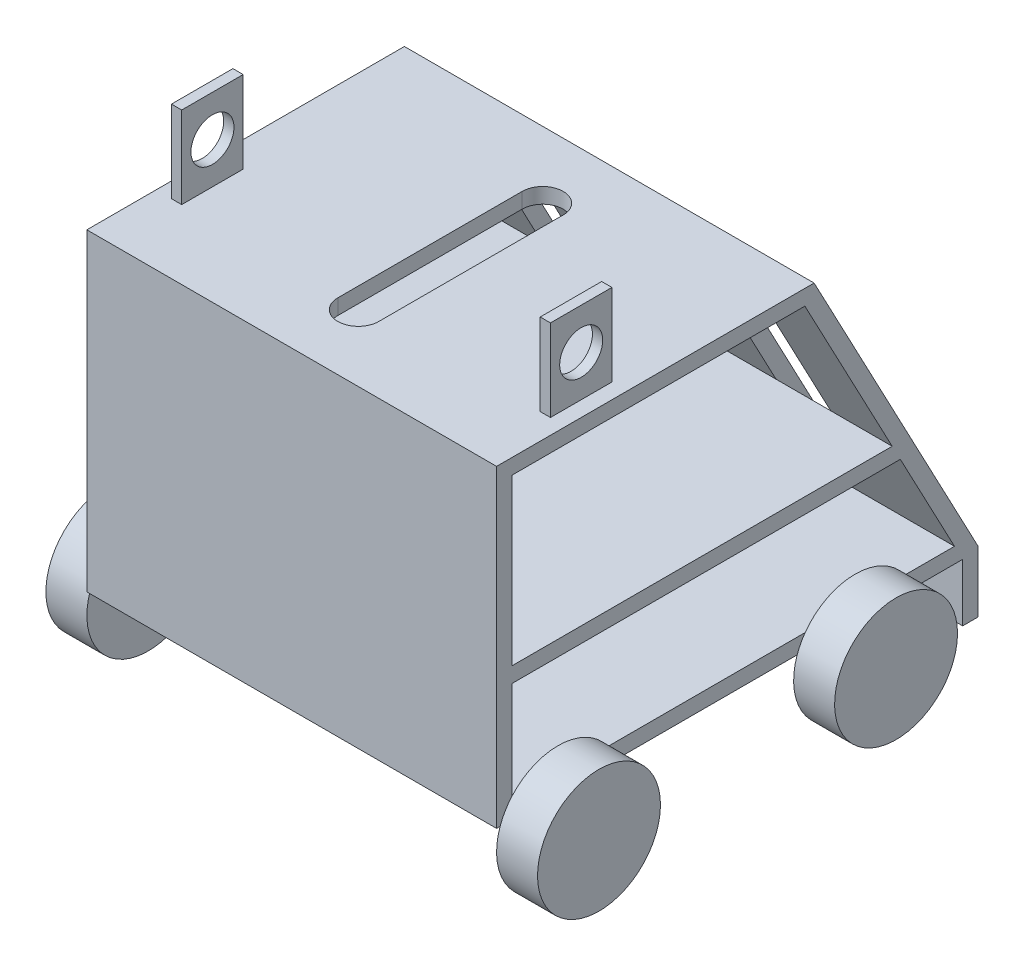
from build123d import *

# Parameters (mm, degrees)
SKETCH2_W           = 38.1
SKETCH2_H           = 50.8
SKETCH2_R           = 13.335
BOSS_EXTRUDE2_DEPTH = 3.175
SKETCH4_W           = 38.1
SKETCH4_H           = 50.8
SKETCH4_R           = 13.335
BOSS_EXTRUDE3_DEPTH = 3.175
BOSS_EXTRUDE4_DEPTH = 127
CUT_EXTRUDE3_DEPTH  = 127
BOSS_EXTRUDE7_DEPTH = 127
SKETCH16_R          = 38.1
BOSS_EXTRUDE8_DEPTH = 25.4
CUT_EXTRUDE6_REACH  = 522.886
SKETCH19_W          = 33.866666667
SKETCH19_H          = 115.824
SKETCH19_W_2        = 33.866666666
CUT_EXTRUDE7_DEPTH  = 34.925


with BuildPart() as part:
    # Sketch2 → Boss-Extrude2 (new, symmetric)
    with BuildSketch(Plane(origin=(63.5, 0, 0), x_dir=(0, 0, -1), z_dir=(1, 0, 0))):
        Rectangle(SKETCH2_W, SKETCH2_H)
        Circle(SKETCH2_R, mode=Mode.SUBTRACT)
    extrude(amount=BOSS_EXTRUDE2_DEPTH, both=True)



with BuildPart() as body_2:
    # Sketch4 → Boss-Extrude3 (new, symmetric)
    with BuildSketch(Plane(origin=(292.1, 0, -263.652), x_dir=(0, 0, 1), z_dir=(-1, 0, 0))):
        with Locations((263.652, 0)):
            Rectangle(SKETCH4_W, SKETCH4_H)
        with Locations(Location((263.652, 0, 0), (0, 0, 180))):
            Circle(SKETCH4_R, mode=Mode.SUBTRACT)
    extrude(amount=BOSS_EXTRUDE3_DEPTH, both=True)


with BuildPart() as part_1:
    add(part.part)

    add(body_2.part)  # Boss-Extrude4 merges body 2
    # Sketch6 → Boss-Extrude4 (add, symmetric)
    with BuildSketch(Plane(origin=(177.8, 0, 0), x_dir=(0, 0, -1), z_dir=(1, 0, 0))):
        Polygon((-19.05, -25.4), (-61.976, -25.4), (-61.976, -255.524), (236.474, -255.524), (236.474, -217.424), (134.874, -25.4), (19.05, -25.4), align=None)
    extrude(amount=BOSS_EXTRUDE4_DEPTH, both=True)

    # Sketch13 → Cut-Extrude3 (cut, symmetric)
    with BuildSketch(Plane(origin=(177.8, 0, 0), x_dir=(0, 0, -1), z_dir=(1, 0, 0))):
        Polygon((-52.451, -34.925), (129.137596743, -34.925), (226.949, -219.788552156), (226.949, -255.524), (-61.976, -255.524), (-61.976, -219.788552156), (-52.451, -219.788552156), align=None)
    extrude(amount=CUT_EXTRUDE3_DEPTH, both=True, mode=Mode.SUBTRACT)

    # Sketch14 → Boss-Extrude7 (add, symmetric)
    with BuildSketch(Plane(origin=(177.8, 0, 0), x_dir=(0, 0, -1), z_dir=(1, 0, 0))):
        Polygon((226.949, -219.788552156), (-52.451, -219.788552156), (-52.451, -210.263552156), (221.90931746, -210.263552156), align=None)
        Polygon((-52.451, -146.763552156), (188.311433862, -146.763552156), (183.271751323, -137.238552156), (-52.451, -137.238552156), align=None)
    extrude(amount=BOSS_EXTRUDE7_DEPTH, both=True)

    # Sketch16 → Boss-Extrude8 (add)
    with BuildSketch(Plane(origin=(304.8, 0, 0), x_dir=(0, 0, -1), z_dir=(1, 0, 0))):
        with Locations(Location((-23.876, -232.488552156, 0), (0, 0, 160.528779366))):
            Circle(SKETCH16_R)
        with Locations(Location((160.274, -232.488552156, 0), (0, 0, 160.528779366))):
            Circle(SKETCH16_R)
    boss_extrude8 = extrude(amount=BOSS_EXTRUDE8_DEPTH)

    # Mirror1: Boss-Extrude8 across plane
    add(boss_extrude8.mirror(Plane(origin=(177.8, 0, 0), x_dir=(0, 0, 1), z_dir=(1, 0, 0))))

    # Cut-Extrude6: up to this plane
    cut_extrude6_end = Plane(origin=(50.8, -34.925, -129.137596743), z_dir=(0, 0.46767282988430103, -0.8839016484813284))
    # Sketch19 → Cut-Extrude6 (cut, up to the surface)
    with BuildSketch(Plane(origin=(0, 0, -236.474), x_dir=(-1, 0, 0), z_dir=(0, 0, -1)), mode=Mode.PRIVATE) as cut_extrude6_sk1:
        with Locations((-249.766666666, -121.412)):
            Rectangle(SKETCH19_W, SKETCH19_H)
    cut_extrude6_tool1 = split(extrude(cut_extrude6_sk1.sketch, amount=-CUT_EXTRUDE6_REACH, mode=Mode.PRIVATE), bisect_by=cut_extrude6_end, keep=Keep.BOTH, mode=Mode.PRIVATE)
    add(cut_extrude6_tool1.solids().sort_by_distance((249.766667, -121.412, -236.474))[0], mode=Mode.SUBTRACT)
    # Sketch19 → Cut-Extrude6 (cut, up to the surface)
    with BuildSketch(Plane(origin=(0, 0, -236.474), x_dir=(-1, 0, 0), z_dir=(0, 0, -1)), mode=Mode.PRIVATE) as cut_extrude6_sk2:
        with Locations((-177.8, -121.412)):
            Rectangle(SKETCH19_W_2, SKETCH19_H)
    cut_extrude6_tool2 = split(extrude(cut_extrude6_sk2.sketch, amount=-CUT_EXTRUDE6_REACH, mode=Mode.PRIVATE), bisect_by=cut_extrude6_end, keep=Keep.BOTH, mode=Mode.PRIVATE)
    add(cut_extrude6_tool2.solids().sort_by_distance((177.8, -121.412, -236.474))[0], mode=Mode.SUBTRACT)
    # Sketch19 → Cut-Extrude6 (cut, up to the surface)
    with BuildSketch(Plane(origin=(0, 0, -236.474), x_dir=(-1, 0, 0), z_dir=(0, 0, -1)), mode=Mode.PRIVATE) as cut_extrude6_sk3:
        with Locations((-105.833333334, -121.412)):
            Rectangle(SKETCH19_W, SKETCH19_H)
    cut_extrude6_tool3 = split(extrude(cut_extrude6_sk3.sketch, amount=-CUT_EXTRUDE6_REACH, mode=Mode.PRIVATE), bisect_by=cut_extrude6_end, keep=Keep.BOTH, mode=Mode.PRIVATE)
    add(cut_extrude6_tool3.solids().sort_by_distance((105.833333, -121.412, -236.474))[0], mode=Mode.SUBTRACT)

    # Sketch20 → Cut-Extrude7 (cut)
    with BuildSketch(Plane(origin=(0, 0, 0), x_dir=(1, 0, 0), z_dir=(0, 1, 0))):
        with BuildLine():
            Line((190.5, 93.599), (190.5, -20.701))
            ThreePointArc((190.5, -20.701), (177.8, -33.401), (165.1, -20.701))
            Line((165.1, -20.701), (165.1, 93.599))
            ThreePointArc((165.1, 93.599), (177.8, 106.299), (190.5, 93.599))
        make_face()
    extrude(amount=-CUT_EXTRUDE7_DEPTH, mode=Mode.SUBTRACT)


solid = part_1.part
